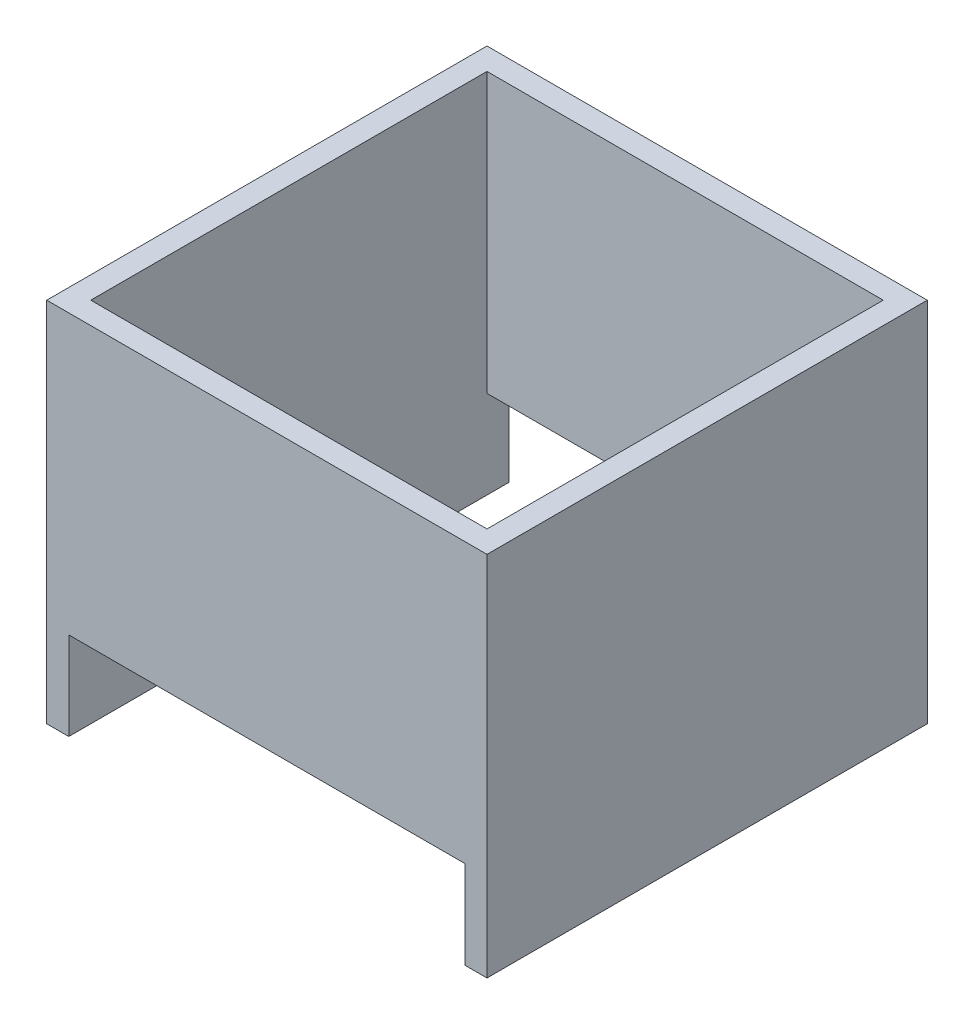
from build123d import *

# Parameters (mm, degrees)
SKETCH_1_W          = 60
SKETCH_1_H          = 60
EXTRUDE_1_DEPTH     = 50
SKETCH_2_W          = 54
SKETCH_2_H          = 54
CUT_EXTRUDE_2_DEPTH = 99.488578018
SKETCH_3_W          = 54
SKETCH_3_H          = 12
CUT_EXTRUDE_3_DEPTH = 99.488578018


with BuildPart() as part:
    # 草图1 → 凸台-拉伸1 (new body)
    with BuildSketch(Plane(origin=(0, 0, 0), x_dir=(1, 0, 0), z_dir=(0, 1, 0))):
        with Locations((30, 30)):
            Rectangle(SKETCH_1_W, SKETCH_1_H)
    extrude(amount=EXTRUDE_1_DEPTH)

    # 草图2 → 切除-拉伸2 (cut, through all)
    with BuildSketch(Plane(origin=(0, 0, 0), x_dir=(1, 0, 0), z_dir=(0, 1, 0))):
        with Locations((30, 30)):
            Rectangle(SKETCH_2_W, SKETCH_2_H)
    extrude(amount=CUT_EXTRUDE_2_DEPTH, mode=Mode.SUBTRACT)

    # 草图3 → 切除-拉伸3 (cut, through all)
    with BuildSketch(Plane.XY):
        with Locations((30, 6)):
            Rectangle(SKETCH_3_W, SKETCH_3_H)
    extrude(amount=-CUT_EXTRUDE_3_DEPTH, mode=Mode.SUBTRACT)


solid = part.part
